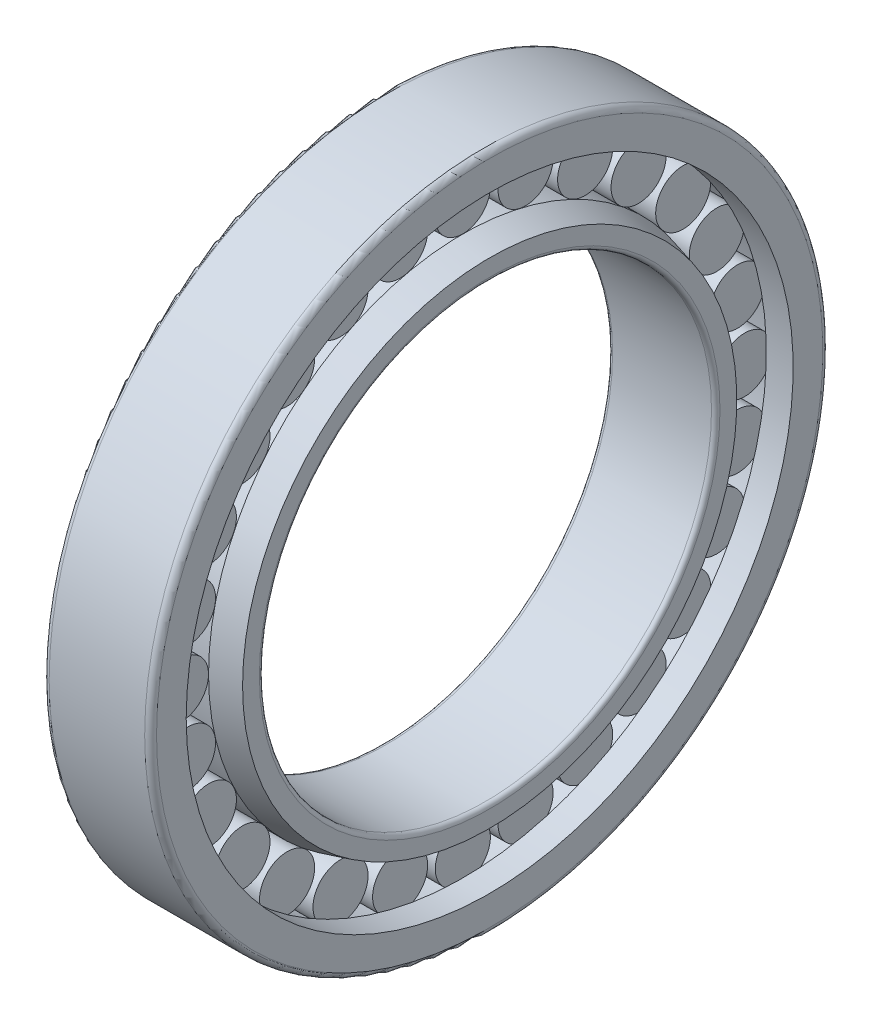
from build123d import *

# Parameters (mm, degrees)
SKETCH_3_W               = 19
SKETCH_3_H               = 9.75
PATTERN_CIRCULAR_2_COUNT = 28


with BuildPart() as part:
    # 草图2 → Revolve 641 (revolve)
    with BuildSketch(Plane.XY):
        with BuildLine():
            Line((9.5, 90), (28.5, 90))
            Line((28.5, 90), (38, 87.454482672))
            Line((38, 87.454482672), (38, 81.5))
            ThreePointArc((38, 81.5), (37.560660172, 80.439339828), (36.5, 80))
            Line((36.5, 80), (1.5, 80))
            ThreePointArc((1.5, 80), (0.439339828, 80.439339828), (0, 81.5))
            Line((0, 81.5), (0, 86.542282774))
            Line((0, 86.542282774), (9.5, 90))
        make_face()
    revolve(axis=Axis((-10.080094127, 0, 0), (1, 0, 0)))


with BuildPart() as body_2:
    # 草图4 → 凸台-旋转2 (revolve)
    with BuildSketch(Plane.XY):
        with BuildLine():
            Line((28.5, 107.4), (38, 107.4))
            Line((38, 107.4), (38, 117.9))
            ThreePointArc((38, 117.9), (37.38492424, 119.38492424), (35.9, 120))
            Line((35.9, 120), (2.1, 120))
            ThreePointArc((2.1, 120), (0.61507576, 119.38492424), (0, 117.9))
            Line((0, 117.9), (0, 107.4))
            Line((0, 107.4), (9.5, 107.4))
            Line((9.5, 107.4), (9.5, 109.5))
            Line((9.5, 109.5), (28.5, 109.5))
            Line((28.5, 109.5), (28.5, 107.4))
        make_face()
    revolve(axis=Axis((0, 0, 0), (1, 0, 0)))


with BuildPart() as body_3:
    # 草图3 → 凸台-旋转1 (revolve)
    with BuildSketch(Plane.XY):
        with Locations((19, 104.625)):
            Rectangle(SKETCH_3_W, SKETCH_3_H)
    revolve(axis=Axis((9.5, 99.75, 0), (1, 0, 0)))


with BuildPart() as pattern_circular_2_1:
    # 阵列(圆周)2: pattern copy
    add(body_3.part.rotate(Axis((-80.9, 0, 0), (1, 0, 0)), 1 * 360 / PATTERN_CIRCULAR_2_COUNT))


with BuildPart() as pattern_circular_2_2:
    # 阵列(圆周)2: pattern copy
    add(body_3.part.rotate(Axis((-80.9, 0, 0), (1, 0, 0)), 2 * 360 / PATTERN_CIRCULAR_2_COUNT))


with BuildPart() as pattern_circular_2_3:
    # 阵列(圆周)2: pattern copy
    add(body_3.part.rotate(Axis((-80.9, 0, 0), (1, 0, 0)), 3 * 360 / PATTERN_CIRCULAR_2_COUNT))


with BuildPart() as pattern_circular_2_4:
    # 阵列(圆周)2: pattern copy
    add(body_3.part.rotate(Axis((-80.9, 0, 0), (1, 0, 0)), 4 * 360 / PATTERN_CIRCULAR_2_COUNT))


with BuildPart() as pattern_circular_2_5:
    # 阵列(圆周)2: pattern copy
    add(body_3.part.rotate(Axis((-80.9, 0, 0), (1, 0, 0)), 5 * 360 / PATTERN_CIRCULAR_2_COUNT))


with BuildPart() as pattern_circular_2_6:
    # 阵列(圆周)2: pattern copy
    add(body_3.part.rotate(Axis((-80.9, 0, 0), (1, 0, 0)), 6 * 360 / PATTERN_CIRCULAR_2_COUNT))


with BuildPart() as pattern_circular_2_7:
    # 阵列(圆周)2: pattern copy
    add(body_3.part.rotate(Axis((-80.9, 0, 0), (1, 0, 0)), 7 * 360 / PATTERN_CIRCULAR_2_COUNT))


with BuildPart() as pattern_circular_2_8:
    # 阵列(圆周)2: pattern copy
    add(body_3.part.rotate(Axis((-80.9, 0, 0), (1, 0, 0)), 8 * 360 / PATTERN_CIRCULAR_2_COUNT))


with BuildPart() as pattern_circular_2_9:
    # 阵列(圆周)2: pattern copy
    add(body_3.part.rotate(Axis((-80.9, 0, 0), (1, 0, 0)), 9 * 360 / PATTERN_CIRCULAR_2_COUNT))


with BuildPart() as pattern_circular_2_10:
    # 阵列(圆周)2: pattern copy
    add(body_3.part.rotate(Axis((-80.9, 0, 0), (1, 0, 0)), 10 * 360 / PATTERN_CIRCULAR_2_COUNT))


with BuildPart() as pattern_circular_2_11:
    # 阵列(圆周)2: pattern copy
    add(body_3.part.rotate(Axis((-80.9, 0, 0), (1, 0, 0)), 11 * 360 / PATTERN_CIRCULAR_2_COUNT))


with BuildPart() as pattern_circular_2_12:
    # 阵列(圆周)2: pattern copy
    add(body_3.part.rotate(Axis((-80.9, 0, 0), (1, 0, 0)), 12 * 360 / PATTERN_CIRCULAR_2_COUNT))


with BuildPart() as pattern_circular_2_13:
    # 阵列(圆周)2: pattern copy
    add(body_3.part.rotate(Axis((-80.9, 0, 0), (1, 0, 0)), 13 * 360 / PATTERN_CIRCULAR_2_COUNT))


with BuildPart() as pattern_circular_2_14:
    # 阵列(圆周)2: pattern copy
    add(body_3.part.rotate(Axis((-80.9, 0, 0), (1, 0, 0)), 14 * 360 / PATTERN_CIRCULAR_2_COUNT))


with BuildPart() as pattern_circular_2_15:
    # 阵列(圆周)2: pattern copy
    add(body_3.part.rotate(Axis((-80.9, 0, 0), (1, 0, 0)), 15 * 360 / PATTERN_CIRCULAR_2_COUNT))


with BuildPart() as pattern_circular_2_16:
    # 阵列(圆周)2: pattern copy
    add(body_3.part.rotate(Axis((-80.9, 0, 0), (1, 0, 0)), 16 * 360 / PATTERN_CIRCULAR_2_COUNT))


with BuildPart() as pattern_circular_2_17:
    # 阵列(圆周)2: pattern copy
    add(body_3.part.rotate(Axis((-80.9, 0, 0), (1, 0, 0)), 17 * 360 / PATTERN_CIRCULAR_2_COUNT))


with BuildPart() as pattern_circular_2_18:
    # 阵列(圆周)2: pattern copy
    add(body_3.part.rotate(Axis((-80.9, 0, 0), (1, 0, 0)), 18 * 360 / PATTERN_CIRCULAR_2_COUNT))


with BuildPart() as pattern_circular_2_19:
    # 阵列(圆周)2: pattern copy
    add(body_3.part.rotate(Axis((-80.9, 0, 0), (1, 0, 0)), 19 * 360 / PATTERN_CIRCULAR_2_COUNT))


with BuildPart() as pattern_circular_2_20:
    # 阵列(圆周)2: pattern copy
    add(body_3.part.rotate(Axis((-80.9, 0, 0), (1, 0, 0)), 20 * 360 / PATTERN_CIRCULAR_2_COUNT))


with BuildPart() as pattern_circular_2_21:
    # 阵列(圆周)2: pattern copy
    add(body_3.part.rotate(Axis((-80.9, 0, 0), (1, 0, 0)), 21 * 360 / PATTERN_CIRCULAR_2_COUNT))


with BuildPart() as pattern_circular_2_22:
    # 阵列(圆周)2: pattern copy
    add(body_3.part.rotate(Axis((-80.9, 0, 0), (1, 0, 0)), 22 * 360 / PATTERN_CIRCULAR_2_COUNT))


with BuildPart() as pattern_circular_2_23:
    # 阵列(圆周)2: pattern copy
    add(body_3.part.rotate(Axis((-80.9, 0, 0), (1, 0, 0)), 23 * 360 / PATTERN_CIRCULAR_2_COUNT))


with BuildPart() as pattern_circular_2_24:
    # 阵列(圆周)2: pattern copy
    add(body_3.part.rotate(Axis((-80.9, 0, 0), (1, 0, 0)), 24 * 360 / PATTERN_CIRCULAR_2_COUNT))


with BuildPart() as pattern_circular_2_25:
    # 阵列(圆周)2: pattern copy
    add(body_3.part.rotate(Axis((-80.9, 0, 0), (1, 0, 0)), 25 * 360 / PATTERN_CIRCULAR_2_COUNT))


with BuildPart() as pattern_circular_2_26:
    # 阵列(圆周)2: pattern copy
    add(body_3.part.rotate(Axis((-80.9, 0, 0), (1, 0, 0)), 26 * 360 / PATTERN_CIRCULAR_2_COUNT))


with BuildPart() as pattern_circular_2_27:
    # 阵列(圆周)2: pattern copy
    add(body_3.part.rotate(Axis((-80.9, 0, 0), (1, 0, 0)), 27 * 360 / PATTERN_CIRCULAR_2_COUNT))


solid = Compound([part.part, body_2.part, body_3.part, pattern_circular_2_1.part, pattern_circular_2_2.part, pattern_circular_2_3.part, pattern_circular_2_4.part, pattern_circular_2_5.part, pattern_circular_2_6.part, pattern_circular_2_7.part, pattern_circular_2_8.part, pattern_circular_2_9.part, pattern_circular_2_10.part, pattern_circular_2_11.part, pattern_circular_2_12.part, pattern_circular_2_13.part, pattern_circular_2_14.part, pattern_circular_2_15.part, pattern_circular_2_16.part, pattern_circular_2_17.part, pattern_circular_2_18.part, pattern_circular_2_19.part, pattern_circular_2_20.part, pattern_circular_2_21.part, pattern_circular_2_22.part, pattern_circular_2_23.part, pattern_circular_2_24.part, pattern_circular_2_25.part, pattern_circular_2_26.part, pattern_circular_2_27.part])
